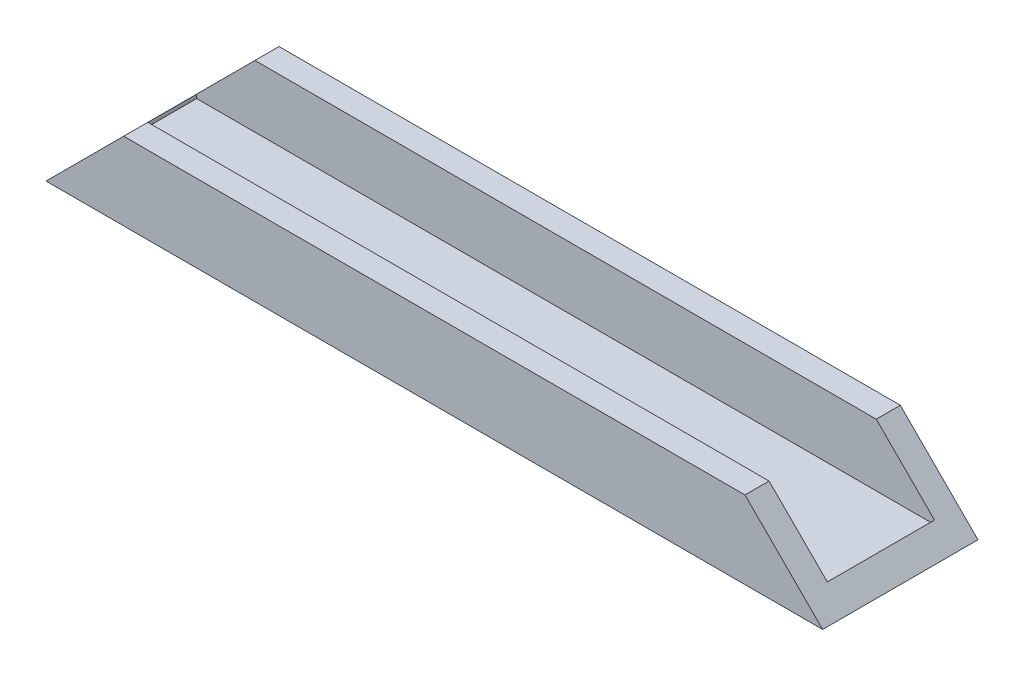
from build123d import *

# Parameters (mm, degrees)
SKETCH1_W          = 127
SKETCH1_H          = 25.4
BASE_EXTRUDE_DEPTH = 12.7
SKETCH3_W          = 120.65
SKETCH3_H          = 17.526
PIECE_CUT_DEPTH    = 10.16
CORNER_CUT_DEPTH   = 131.136274728


with BuildPart() as part:
    # Sketch1 → Base Extrude (new body)
    with BuildSketch(Plane(origin=(0, 0, 0), x_dir=(1, 0, 0), z_dir=(0, 1, 0))):
        with Locations((63.5, 12.7)):
            Rectangle(SKETCH1_W, SKETCH1_H)
    extrude(amount=BASE_EXTRUDE_DEPTH)

    # Sketch3 → Piece Cut (cut)
    with BuildSketch(Plane(origin=(0, 12.7, 0), x_dir=(1, 0, 0), z_dir=(0, 1, 0))):
        with Locations((63.5, 12.7)):
            Rectangle(SKETCH3_W, SKETCH3_H)
    extrude(amount=-PIECE_CUT_DEPTH, mode=Mode.SUBTRACT)

    # Sketch4 → Corner Cut (cut, through all)
    with BuildSketch(Plane(origin=(0, 0, -25.4), x_dir=(-1, 0, 0), z_dir=(0, 0, -1))):
        Polygon((0, 0), (-12.7, 12.7), (0, 12.7), align=None)
        Polygon((-127, 12.7), (-114.3, 12.7), (-127, 0), align=None)
    extrude(amount=-CORNER_CUT_DEPTH, mode=Mode.SUBTRACT)


solid = part.part
